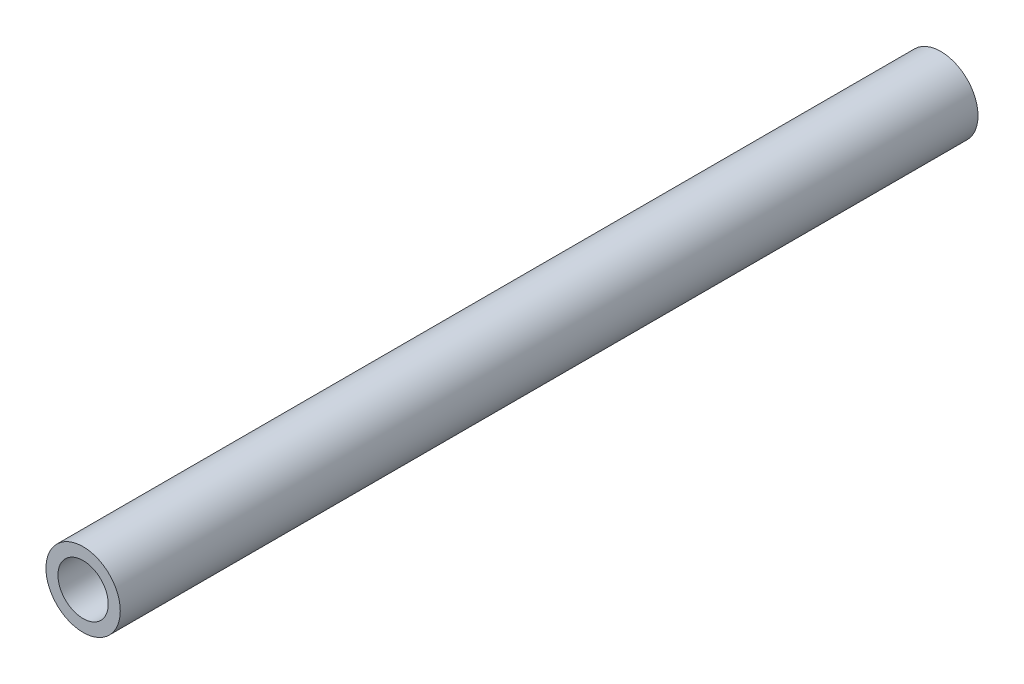
from build123d import *

# Parameters (mm, degrees)
SKETCH2_R           = 6.5
SKETCH2_R_2         = 4.4
BOSS_EXTRUDE1_DEPTH = 150


with BuildPart() as part:
    # Sketch2 → Boss-Extrude1 (new body)
    with BuildSketch(Plane.XY):
        Circle(SKETCH2_R)
        Circle(SKETCH2_R_2, mode=Mode.SUBTRACT)
    extrude(amount=BOSS_EXTRUDE1_DEPTH)


solid = part.part
